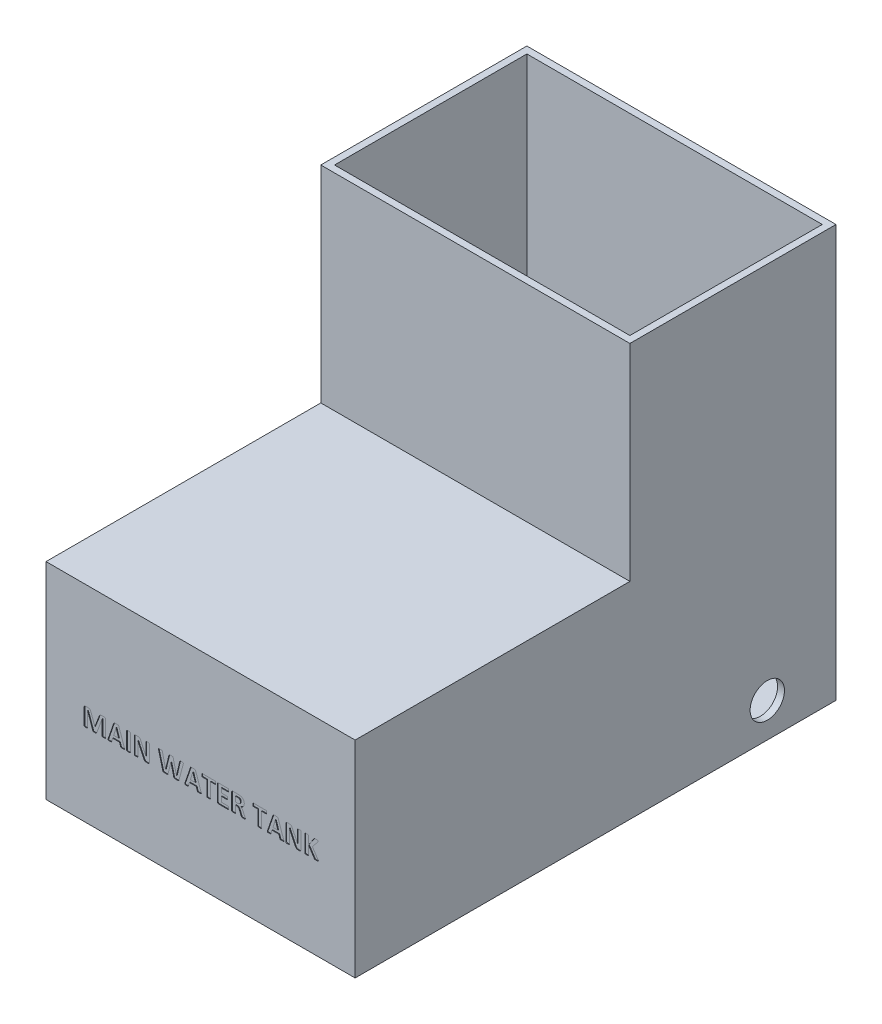
from build123d import *

# Parameters (mm, degrees)
SKETCH1_W           = 450
SKETCH1_H           = 400
BOSS_EXTRUDE1_DEPTH = 300
SKETCH3_W           = 450
SKETCH3_H           = 300
BOSS_EXTRUDE2_DEPTH = 600
SHELL3_T            = -10
CUT_EXTRUDE1_REACH  = 903.388
SKETCH5_R           = 25
CUT_EXTRUDE2_DEPTH  = 1


with BuildPart() as part:
    # Sketch1 → Boss-Extrude1 (new body)
    with BuildSketch(Plane(origin=(0, 0, 0), x_dir=(1, 0, 0), z_dir=(0, 1, 0))):
        Rectangle(SKETCH1_W, SKETCH1_H)
    extrude(amount=BOSS_EXTRUDE1_DEPTH)

    # Sketch3 → Boss-Extrude2 (add)
    with BuildSketch(Plane(origin=(0, 0, 0), x_dir=(1, 0, 0), z_dir=(0, 1, 0))):
        with Locations((0, 350)):
            Rectangle(SKETCH3_W, SKETCH3_H)
    extrude(amount=BOSS_EXTRUDE2_DEPTH)

    # Shell3
    shell3_openings = [part.faces().sort_by_distance(p)[0] for p in [
        (0, 600, -350),
    ]]
    offset(amount=SHELL3_T, openings=shell3_openings, kind=Kind.INTERSECTION)

    # Sketch5 → Cut-Extrude1 (cut, up to next)
    with BuildSketch(Plane(origin=(225, 0, 0), x_dir=(0, 0, -1), z_dir=(1, 0, 0)), mode=Mode.PRIVATE) as cut_extrude1_sk1:
        with Locations((400, 50)):
            Circle(SKETCH5_R)
    cut_extrude1_tool1 = extrude(cut_extrude1_sk1.sketch, amount=-CUT_EXTRUDE1_REACH, mode=Mode.PRIVATE) & part.part
    add(cut_extrude1_tool1.solids().sort_by_distance((225, 50, -400))[0], mode=Mode.SUBTRACT)

    # Sketch6 → Cut-Extrude2 (cut)
    # profile 1 of 13: a face of its own
    with BuildSketch(Plane.XY.offset(200)):
        with BuildLine():
            add(Edge.make_bspline(
                [(-138.322610294, 120.857220818), (-138.328988076, 120.791591808), (-138.341707054, 120.660710247), (-138.43073585, 120.472537539), (-138.606275854, 120.317906263), (-138.868093149, 120.209130229), (-139.21453384, 120.122228623), (-139.659517481, 120.04821173), (-140.22088397, 120.011401318), (-140.634840904, 120.00406116), (-140.863874847, 120)],
                knots=[0, 0, 0, 0, 0.53931148, 1.075529369, 1.664717629, 2.417171342, 3.3825244, 4.59796581, 6.11772375, 8, 8, 8, 8], degree=3))
            add(Edge.make_bspline(
                [(-140.863874847, 120), (-141.08677583, 120.004254973), (-141.492533144, 120.012000505), (-142.04637684, 120.047316457), (-142.485181407, 120.125322745), (-142.83293511, 120.198525314), (-143.085436478, 120.322545284), (-143.265578864, 120.471466481), (-143.361938599, 120.657497755), (-143.374609281, 120.787438048), (-143.380821078, 120.851141238)],
                knots=[0, 0, 0, 0, 1.853491538, 3.373999249, 4.603471061, 5.559413693, 6.312685071, 6.921158648, 7.471098346, 8, 8, 8, 8], degree=3))
            Line((-143.380821078, 120.851141238), (-143.380821078, 142.178308824))
            Line((-143.380821078, 142.178308824), (-143.42337814, 142.178308824))
            Line((-143.42337814, 142.178308824), (-151.278195849, 120.875459559))
            add(Edge.make_bspline(
                [(-151.278195849, 120.875459559), (-151.310361242, 120.792152176), (-151.372761692, 120.630536923), (-151.541065349, 120.424104841), (-151.773443967, 120.270592005), (-152.065785171, 120.148788624), (-152.435446863, 120.065783535), (-152.888346606, 120.024296543), (-153.436180583, 120.001284032), (-153.833613582, 120.000453309), (-154.050484452, 120)],
                knots=[0, 0, 0, 0, 0.686484186, 1.331770514, 2.017719291, 2.817120945, 3.76613975, 4.931024301, 6.325324192, 8, 8, 8, 8], degree=3))
            add(Edge.make_bspline(
                [(-154.050484452, 120), (-154.265329064, 120.002081485), (-154.660939361, 120.005914288), (-155.207695392, 120.038956227), (-155.661664789, 120.103535928), (-156.03388503, 120.19579303), (-156.324377464, 120.327076582), (-156.556975921, 120.470194253), (-156.717229477, 120.659275056), (-156.771830866, 120.804598993), (-156.798454733, 120.875459559)],
                knots=[0, 0, 0, 0, 1.685888108, 3.104358486, 4.294019542, 5.281467246, 6.100061193, 6.788077155, 7.409061302, 8, 8, 8, 8], degree=3))
            Line((-156.798454733, 120.875459559), (-164.349293428, 142.178308824))
            Line((-164.349293428, 142.178308824), (-164.39185049, 142.178308824))
            Line((-164.39185049, 142.178308824), (-164.39185049, 120.851141238))
            add(Edge.make_bspline(
                [(-164.39185049, 120.851141238), (-164.398485261, 120.787606691), (-164.411924227, 120.658915178), (-164.499843833, 120.47227323), (-164.67811813, 120.31732676), (-164.941109501, 120.200068015), (-165.295582108, 120.126324488), (-165.736540456, 120.047635327), (-166.294266981, 120.011322551), (-166.70411793, 120.004058604), (-166.933115043, 120)],
                knots=[0, 0, 0, 0, 0.523881482, 1.061140814, 1.651473397, 2.427583288, 3.406823418, 4.62462546, 6.11406799, 8, 8, 8, 8], degree=3))
            add(Edge.make_bspline(
                [(-166.933115043, 120), (-167.156059037, 120.004134635), (-167.561894646, 120.011661109), (-168.115261789, 120.048310383), (-168.559755881, 120.123375907), (-168.909218936, 120.207894012), (-169.171702826, 120.318325077), (-169.349437748, 120.470963587), (-169.429438647, 120.662329185), (-169.443143796, 120.791848029), (-169.450061275, 120.857220818)],
                knots=[0, 0, 0, 0, 1.845598522, 3.359631215, 4.583867372, 5.572415917, 6.33031427, 6.923765806, 7.456786145, 8, 8, 8, 8], degree=3))
            Line((-169.450061275, 120.857220818), (-169.450061275, 144.318321078))
            add(Edge.make_bspline(
                [(-169.450061275, 144.318321078), (-169.443229181, 144.481024454), (-169.430179678, 144.791792742), (-169.327995798, 145.227734692), (-169.156364307, 145.604363029), (-168.913213548, 145.914641397), (-168.612877049, 146.161836402), (-168.257506242, 146.331772506), (-167.859325721, 146.438945767), (-167.578282083, 146.45168587), (-167.431640625, 146.458333333)],
                knots=[0, 0, 0, 0, 1.170986061, 2.236618205, 3.203067292, 4.128640435, 5.05190886, 5.978862082, 6.945421388, 8, 8, 8, 8], degree=3))
            Line((-167.431640625, 146.458333333), (-163.917643229, 146.458333333))
            add(Edge.make_bspline(
                [(-163.917643229, 146.458333333), (-163.627364755, 146.452960748), (-163.086671153, 146.442953383), (-162.333718355, 146.32958902), (-161.682228084, 146.134485564), (-161.136566877, 145.814351863), (-160.666871807, 145.395787114), (-160.298617731, 144.84709899), (-159.981541996, 144.185593453), (-159.833020611, 143.69078237), (-159.753130744, 143.424622779)],
                knots=[0, 0, 0, 0, 1.221860144, 2.275924746, 3.199259799, 4.067557721, 4.91975897, 5.826849192, 6.83105906, 8, 8, 8, 8], degree=3))
            Line((-159.753130744, 143.424622779), (-153.886335784, 127.733226103))
            Line((-153.886335784, 127.733226103), (-153.801221661, 127.733226103))
            Line((-153.801221661, 127.733226103), (-147.69124349, 143.382065717))
            add(Edge.make_bspline(
                [(-147.69124349, 143.382065717), (-147.603018532, 143.647388745), (-147.438651477, 144.141697451), (-147.134417442, 144.809253764), (-146.794851864, 145.358730543), (-146.396227332, 145.794821319), (-145.92787215, 146.124524871), (-145.372843916, 146.328506029), (-144.741349978, 146.441801327), (-144.293278926, 146.452604247), (-144.055654488, 146.458333333)],
                knots=[0, 0, 0, 0, 1.280036071, 2.384764634, 3.352991371, 4.226577935, 5.073725477, 5.949430069, 6.912526206, 8, 8, 8, 8], degree=3))
            Line((-144.055654488, 146.458333333), (-140.444383808, 146.458333333))
            add(Edge.make_bspline(
                [(-140.444383808, 146.458333333), (-140.27326206, 146.452944755), (-139.953305092, 146.442869395), (-139.512118259, 146.327687643), (-139.133774381, 146.162586344), (-138.834893841, 145.909335288), (-138.602472904, 145.594600075), (-138.442566966, 145.217431758), (-138.334085104, 144.786351077), (-138.326553513, 144.479155522), (-138.322610294, 144.318321078)],
                knots=[0, 0, 0, 0, 1.189765225, 2.224577975, 3.160009884, 4.042747863, 4.921519989, 5.863966938, 6.881664521, 8, 8, 8, 8], degree=3))
            Line((-138.322610294, 144.318321078), (-138.322610294, 120.857220818))
        make_face()
    # profile 2 of 13: a face of its own
    with BuildSketch(Plane.XY.offset(200)):
        with BuildLine():
            add(Edge.make_bspline(
                [(-110.891544118, 122.109614354), (-110.8516296, 121.994539986), (-110.777221586, 121.780020162), (-110.692826331, 121.470326633), (-110.625226819, 121.201192257), (-110.579143746, 120.966510408), (-110.561808304, 120.763267235), (-110.587470729, 120.587976696), (-110.639832865, 120.433101083), (-110.743585158, 120.308885509), (-110.883095929, 120.207655229), (-111.068364248, 120.138573533), (-111.291373794, 120.076511657), (-111.561511231, 120.043651259), (-111.878427785, 120.03056614), (-112.244995629, 120.007617957), (-112.668842049, 120.006919226), (-112.968747075, 120.002407994), (-113.128829657, 120)],
                knots=[0, 0, 0, 0, 1.351975101, 2.52033068, 3.562719996, 4.432170766, 5.176088948, 5.812532786, 6.389296298, 6.965620705, 7.577732788, 8.283941723, 9.146375963, 10.145613058, 11.295182858, 12.669444765, 14.222224263, 16, 16, 16, 16], degree=3))
            add(Edge.make_bspline(
                [(-113.128829657, 120), (-113.292976139, 119.999609239), (-113.603044679, 119.9988711), (-114.038854426, 120.003712546), (-114.417683727, 120.018285792), (-114.823835328, 120.029418538), (-115.230728963, 120.068139739), (-115.621983013, 120.131971726), (-115.90276152, 120.238905599), (-116.093991463, 120.396618094), (-116.203154214, 120.605206179), (-116.255797023, 120.753229501), (-116.284131817, 120.832902497)],
                knots=[0, 0, 0, 0, 1.402041787, 2.648421349, 3.722147351, 4.640185661, 6.117966101, 7.211050041, 8.017924191, 8.656254393, 9.276733986, 10, 10, 10, 10], degree=3))
            Line((-116.284131817, 120.832902497), (-117.901300169, 125.836397059))
            Line((-117.901300169, 125.836397059), (-127.883970971, 125.836397059))
            Line((-127.883970971, 125.836397059), (-129.416025199, 120.972732843))
            add(Edge.make_bspline(
                [(-129.416025199, 120.972732843), (-129.443752703, 120.884713022), (-129.496553959, 120.717097606), (-129.616453428, 120.485580756), (-129.809566712, 120.303011001), (-130.081846419, 120.165939025), (-130.457871884, 120.083675106), (-130.950180117, 120.023860215), (-131.588489743, 120.010269187), (-132.062726867, 120.003684991), (-132.328144148, 120)],
                knots=[0, 0, 0, 0, 0.662368552, 1.261342941, 1.847645799, 2.537239812, 3.42265718, 4.595262896, 6.094463672, 8, 8, 8, 8], degree=3))
            add(Edge.make_bspline(
                [(-132.328144148, 120), (-132.476087273, 120.001525247), (-132.755810555, 120.004409107), (-133.151098974, 120.016084606), (-133.495657135, 120.034525263), (-133.792648735, 120.055109454), (-134.041719454, 120.095430131), (-134.25117521, 120.156791637), (-134.420510192, 120.237604109), (-134.594798169, 120.380107688), (-134.710385748, 120.656349141), (-134.69696794, 121.062574302), (-134.568619053, 121.565980297), (-134.450163099, 121.94015335), (-134.383042279, 122.152171415)],
                knots=[0, 0, 0, 0, 1.279822224, 2.419822313, 3.420424811, 4.264789446, 4.993926375, 5.598399463, 6.14718048, 6.607326483, 7.517039103, 8.604050794, 10.075749779, 12, 12, 12, 12], degree=3))
            Line((-134.383042279, 122.152171415), (-126.382314645, 145.406565947))
            add(Edge.make_bspline(
                [(-126.382314645, 145.406565947), (-126.340510943, 145.51108387), (-126.263205294, 145.704364021), (-126.109208731, 145.968231653), (-125.878194819, 146.174323496), (-125.54214764, 146.301587817), (-125.102814429, 146.397877715), (-124.65010252, 146.427302492), (-124.213981433, 146.440259857), (-123.818840947, 146.454304786), (-123.372938524, 146.459540733), (-123.058811536, 146.458751071), (-122.89263557, 146.458333333)],
                knots=[0, 0, 0, 0, 0.856868194, 1.584566637, 2.305859304, 3.162727498, 4.285524966, 5.725550839, 6.605441018, 7.608682037, 8.734971556, 10, 10, 10, 10], degree=3))
            add(Edge.make_bspline(
                [(-122.89263557, 146.458333333), (-122.702141329, 146.458733727), (-122.339379737, 146.459496204), (-121.826610995, 146.454416602), (-121.374712393, 146.440402567), (-120.881934021, 146.427075293), (-120.376813067, 146.399045154), (-119.886524958, 146.302045669), (-119.517339678, 146.172300629), (-119.260097621, 145.956955781), (-119.092836308, 145.672971209), (-119.017981795, 145.46082409), (-118.977385876, 145.345770144)],
                knots=[0, 0, 0, 0, 1.298203691, 2.47219252, 3.494555852, 4.378870695, 5.833194716, 6.932857721, 7.781737059, 8.467837287, 9.169060755, 10, 10, 10, 10], degree=3))
            Line((-118.977385876, 145.345770144), (-110.891544118, 122.109614354))
        make_face()
        Polygon((-122.953431373, 141.515634574), (-122.971670113, 141.515634574), (-126.540383732, 130.116421569), (-119.28136489, 130.116421569), align=None, mode=Mode.SUBTRACT)
    # profile 3 of 13: a face of its own
    with BuildSketch(Plane.XY.offset(200)):
        with BuildLine():
            add(Edge.make_bspline(
                [(-102.136948529, 120.851141238), (-102.142358465, 120.787024341), (-102.153559926, 120.65426808), (-102.267154458, 120.470938348), (-102.45982677, 120.319480374), (-102.735190296, 120.199970681), (-103.107414237, 120.124895644), (-103.579076282, 120.047139591), (-104.177229528, 120.011836126), (-104.617423751, 120.004211871), (-104.86060049, 120)],
                knots=[0, 0, 0, 0, 0.495621344, 1.026201209, 1.620351712, 2.38321719, 3.340319487, 4.57034235, 6.105352312, 8, 8, 8, 8], degree=3))
            add(Edge.make_bspline(
                [(-104.86060049, 120), (-105.099704593, 120.004399941), (-105.537828303, 120.012462197), (-106.134166912, 120.046443359), (-106.609351484, 120.126011115), (-106.984601975, 120.198716155), (-107.260434385, 120.319990848), (-107.455764159, 120.469060588), (-107.558811015, 120.656674414), (-107.57590813, 120.787359714), (-107.584252451, 120.851141238)],
                knots=[0, 0, 0, 0, 1.864371396, 3.416191113, 4.647059884, 5.620195157, 6.383585271, 6.978144381, 7.501278959, 8, 8, 8, 8], degree=3))
            Line((-107.584252451, 120.851141238), (-107.584252451, 145.607192096))
            add(Edge.make_bspline(
                [(-107.584252451, 145.607192096), (-107.576498802, 145.673215443), (-107.561065, 145.80463631), (-107.453071722, 145.991729445), (-107.256273507, 146.137536486), (-106.974391873, 146.251382586), (-106.600398455, 146.335083766), (-106.125414291, 146.408151354), (-105.534351001, 146.456784164), (-105.099836221, 146.457783253), (-104.86060049, 146.458333333)],
                knots=[0, 0, 0, 0, 0.514492339, 1.024107864, 1.631220341, 2.388587514, 3.381256653, 4.612737383, 6.135036404, 8, 8, 8, 8], degree=3))
            add(Edge.make_bspline(
                [(-104.86060049, 146.458333333), (-104.617284698, 146.457872141), (-104.17664827, 146.457036937), (-103.579793698, 146.407891723), (-103.105765526, 146.337461199), (-102.738038355, 146.248506896), (-102.458124559, 146.140267103), (-102.269598897, 145.987619421), (-102.15120746, 145.807275548), (-102.141683553, 145.673634657), (-102.136948529, 145.607192096)],
                knots=[0, 0, 0, 0, 1.894249435, 3.430419785, 4.660397522, 5.621231422, 6.377674247, 6.971802951, 7.488808818, 8, 8, 8, 8], degree=3))
            Line((-102.136948529, 145.607192096), (-102.136948529, 120.851141238))
        make_face()
    # profile 4 of 13: a face of its own
    with BuildSketch(Plane.XY.offset(200)):
        with BuildLine():
            add(Edge.make_bspline(
                [(-74.511335784, 121.915067785), (-74.518555448, 121.766007981), (-74.532499906, 121.478105649), (-74.665692505, 121.079085856), (-74.861479765, 120.736285051), (-75.123193273, 120.457560706), (-75.439446187, 120.239339627), (-75.804611876, 120.097857442), (-76.194215665, 120.021115537), (-76.458517645, 120.007034378), (-76.590552237, 120)],
                knots=[0, 0, 0, 0, 1.120032347, 2.163292293, 3.135130692, 4.07524891, 5.019946156, 6.00690811, 7.004331812, 8, 8, 8, 8], degree=3))
            Line((-76.590552237, 120), (-78.949429381, 120))
            add(Edge.make_bspline(
                [(-78.949429381, 120), (-79.17877411, 120.006339978), (-79.606076885, 120.018152284), (-80.214493595, 120.122137635), (-80.752316346, 120.343072501), (-81.23941737, 120.684822126), (-81.688919653, 121.156851637), (-82.115742411, 121.770622498), (-82.546594854, 122.539635814), (-82.827205018, 123.111194922), (-82.9801911, 123.422803692)],
                knots=[0, 0, 0, 0, 0.966254035, 1.800272596, 2.585200708, 3.395271146, 4.288963202, 5.317323791, 6.537429596, 8, 8, 8, 8], degree=3))
            Line((-82.9801911, 123.422803692), (-89.150965074, 136.044012331))
            add(Edge.make_bspline(
                [(-89.150965074, 136.044012331), (-89.332721906, 136.432462184), (-89.708684609, 137.235967914), (-90.25385454, 138.471984662), (-90.767717258, 139.740334105), (-91.086143627, 140.59284763), (-91.242340686, 141.011029412)],
                knots=[0, 0, 0, 0, 0.954558477, 1.974497353, 3.006434174, 4, 4, 4, 4], degree=3))
            Line((-91.242340686, 141.011029412), (-91.284897748, 141.011029412))
            add(Edge.make_bspline(
                [(-91.284897748, 141.011029412), (-91.273428065, 140.512525813), (-91.250537302, 139.517631034), (-91.240131383, 138.019888205), (-91.242916732, 136.502008488), (-91.242534723, 135.480638267), (-91.242340686, 134.961847044)],
                knots=[0, 0, 0, 0, 0.989090355, 1.973989423, 2.970915262, 4, 4, 4, 4], degree=3))
            Line((-91.242340686, 134.961847044), (-91.242340686, 120.8936983))
            add(Edge.make_bspline(
                [(-91.242340686, 120.8936983), (-91.24847816, 120.82792779), (-91.26097155, 120.694045893), (-91.357133864, 120.504643303), (-91.530570428, 120.344236853), (-91.784795754, 120.218222799), (-92.131950853, 120.12735388), (-92.578559725, 120.046281296), (-93.14885803, 120.01198749), (-93.568804455, 120.00427813), (-93.80184398, 120)],
                knots=[0, 0, 0, 0, 0.533239368, 1.085457576, 1.679302583, 2.423102222, 3.366158425, 4.586936804, 6.105999776, 8, 8, 8, 8], degree=3))
            add(Edge.make_bspline(
                [(-93.80184398, 120), (-94.028818579, 120.004169823), (-94.442708461, 120.011773527), (-95.004421446, 120.047951055), (-95.449234102, 120.121612001), (-95.79286667, 120.208566861), (-96.035271997, 120.340785978), (-96.205832495, 120.49064075), (-96.287554273, 120.680083467), (-96.296197988, 120.810017266), (-96.300551471, 120.875459559)],
                knots=[0, 0, 0, 0, 1.880338663, 3.428811631, 4.65383513, 5.615149483, 6.343797838, 6.92541045, 7.458773589, 8, 8, 8, 8], degree=3))
            Line((-96.300551471, 120.875459559), (-96.300551471, 144.543265548))
            add(Edge.make_bspline(
                [(-96.300551471, 144.543265548), (-96.29448518, 144.694013321), (-96.28298664, 144.979752908), (-96.171940497, 145.378750124), (-95.987505466, 145.719592894), (-95.722671108, 145.988364751), (-95.413471474, 146.203266873), (-95.059272962, 146.346180523), (-94.678377886, 146.442754499), (-94.412459499, 146.453051352), (-94.276051241, 146.458333333)],
                knots=[0, 0, 0, 0, 1.146599659, 2.173358234, 3.127386818, 4.066803063, 5.022080866, 5.977233821, 6.962380843, 8, 8, 8, 8], degree=3))
            Line((-94.276051241, 146.458333333), (-91.272738588, 146.458333333))
            add(Edge.make_bspline(
                [(-91.272738588, 146.458333333), (-91.022914758, 146.455213429), (-90.565237131, 146.44949776), (-89.931927042, 146.342563897), (-89.38309123, 146.175181842), (-88.904129076, 145.89634296), (-88.466848372, 145.520012029), (-88.071001709, 145.025330449), (-87.693407131, 144.414415077), (-87.470665721, 143.955869634), (-87.351409314, 143.710363051)],
                knots=[0, 0, 0, 0, 1.157819279, 2.121126641, 2.971782284, 3.805898374, 4.67303314, 5.635237899, 6.733899397, 8, 8, 8, 8], degree=3))
            Line((-87.351409314, 143.710363051), (-82.54246132, 134.086387485))
            add(Edge.make_bspline(
                [(-82.54246132, 134.086387485), (-82.402226882, 133.796787544), (-82.124911323, 133.224099621), (-81.718381263, 132.366584173), (-81.305193138, 131.525142088), (-80.921462178, 130.680604947), (-80.543082432, 129.848355178), (-80.178535018, 129.024563029), (-79.817869731, 128.208728521), (-79.583312073, 127.664507711), (-79.466193704, 127.392769608)],
                knots=[0, 0, 0, 0, 1.048159491, 2.072750013, 3.091389825, 4.101587992, 5.094292605, 6.069547355, 7.0360943, 8, 8, 8, 8], degree=3))
            Line((-79.466193704, 127.392769608), (-79.447954963, 127.392769608))
            add(Edge.make_bspline(
                [(-79.447954963, 127.392769608), (-79.467749211, 127.875033939), (-79.508160697, 128.859613835), (-79.539814278, 130.347353605), (-79.567435787, 131.830761718), (-79.56885473, 132.811688837), (-79.569546569, 133.289962469)],
                knots=[0, 0, 0, 0, 0.981864332, 2.004551901, 3.027073275, 4, 4, 4, 4], degree=3))
            Line((-79.569546569, 133.289962469), (-79.569546569, 145.588953355))
            add(Edge.make_bspline(
                [(-79.569546569, 145.588953355), (-79.564144287, 145.65309547), (-79.553193763, 145.783112717), (-79.443090416, 145.963943897), (-79.26076072, 146.119554589), (-78.997065885, 146.252082649), (-78.643106763, 146.352424029), (-78.189138436, 146.412068808), (-77.620885085, 146.455768733), (-77.200660491, 146.457418121), (-76.967486213, 146.458333333)],
                knots=[0, 0, 0, 0, 0.513514522, 1.040903369, 1.654763982, 2.430140109, 3.402872071, 4.610164628, 6.119047709, 8, 8, 8, 8], degree=3))
            add(Edge.make_bspline(
                [(-76.967486213, 146.458333333), (-76.744433279, 146.457379295), (-76.338361569, 146.455642453), (-75.786452224, 146.411255806), (-75.345927101, 146.354663063), (-75.010884313, 146.254285375), (-74.773244314, 146.118818781), (-74.617334962, 145.959377371), (-74.52123482, 145.778899807), (-74.514667979, 145.64885969), (-74.511335784, 145.582873775)],
                knots=[0, 0, 0, 0, 1.872486456, 3.408893843, 4.648537669, 5.595853804, 6.328496016, 6.918324485, 7.451128226, 8, 8, 8, 8], degree=3))
            Line((-74.511335784, 145.582873775), (-74.511335784, 121.915067785))
        make_face()
    # profile 5 of 13: a face of its own
    with BuildSketch(Plane.XY.offset(200)):
        with BuildLine():
            add(Edge.make_bspline(
                [(-31.413191253, 121.477338006), (-31.456791553, 121.329788498), (-31.537163343, 121.057799132), (-31.726143074, 120.691533754), (-32.016624517, 120.41792779), (-32.408260329, 120.229841379), (-32.906834902, 120.110564726), (-33.528658637, 120.035039613), (-34.300729613, 120.00660726), (-34.86842232, 120.002353589), (-35.18253102, 120)],
                knots=[0, 0, 0, 0, 0.828472167, 1.527186518, 2.191185698, 2.938119969, 3.840992575, 4.941785944, 6.307866865, 8, 8, 8, 8], degree=3))
            add(Edge.make_bspline(
                [(-35.18253102, 120), (-35.364906167, 120.002406446), (-35.711421324, 120.006978725), (-36.20414292, 120.007629291), (-36.63957602, 120.030818102), (-37.121631806, 120.047264834), (-37.620523419, 120.109768955), (-38.116482001, 120.226150597), (-38.490898394, 120.416502883), (-38.749252669, 120.696906231), (-38.911736129, 121.06029047), (-38.97702679, 121.330073337), (-39.01266659, 121.477338006)],
                knots=[0, 0, 0, 0, 1.200390798, 2.280758157, 3.241844714, 4.069696988, 5.454290943, 6.544491945, 7.409847109, 8.174247725, 9.003388151, 10, 10, 10, 10], degree=3))
            Line((-39.01266659, 121.477338006), (-43.146781173, 138.092830882))
            Line((-43.146781173, 138.092830882), (-43.189338235, 138.092830882))
            Line((-43.189338235, 138.092830882), (-47.280895757, 121.477338006))
            add(Edge.make_bspline(
                [(-47.280895757, 121.477338006), (-47.316457953, 121.335914503), (-47.383013225, 121.071237945), (-47.553052219, 120.716250072), (-47.808107737, 120.426504915), (-48.185924884, 120.235163409), (-48.677556079, 120.106754276), (-49.17408569, 120.047503497), (-49.649909767, 120.031027683), (-50.081311811, 120.007382126), (-50.567954984, 120.007073853), (-50.912443723, 120.002430774), (-51.092792586, 120)],
                knots=[0, 0, 0, 0, 0.964606664, 1.805278237, 2.584746217, 3.474186178, 4.562364076, 5.943010412, 6.776466711, 7.71722888, 8.804909628, 10, 10, 10, 10], degree=3))
            add(Edge.make_bspline(
                [(-51.092792586, 120), (-51.283274336, 120.002404185), (-51.641950108, 120.006931248), (-52.150871787, 120.007654514), (-52.598482972, 120.030870093), (-53.092617296, 120.047135089), (-53.601956584, 120.108755795), (-54.106591416, 120.228078233), (-54.490544215, 120.414473068), (-54.756987286, 120.696103275), (-54.923831483, 121.061385362), (-55.001848762, 121.330272235), (-55.044519761, 121.477338006)],
                knots=[0, 0, 0, 0, 1.226427643, 2.309354474, 3.275578471, 4.111462609, 5.491790153, 6.570859358, 7.440377765, 8.197066898, 9.013898509, 10, 10, 10, 10], degree=3))
            Line((-55.044519761, 121.477338006), (-61.087622549, 144.34871898))
            add(Edge.make_bspline(
                [(-61.087622549, 144.34871898), (-61.114542275, 144.464106399), (-61.164940551, 144.680131147), (-61.227348069, 144.985932632), (-61.268931618, 145.252081177), (-61.306612676, 145.539013993), (-61.282643263, 145.859073936), (-61.102227305, 146.106778188), (-60.906118234, 146.245652923), (-60.711003107, 146.319071758), (-60.478110962, 146.374529029), (-60.202741244, 146.407662472), (-59.876044496, 146.430123156), (-59.494994972, 146.450016682), (-59.057021028, 146.451589341), (-58.746975608, 146.455998889), (-58.582835478, 146.458333333)],
                knots=[0, 0, 0, 0, 1.131713364, 2.118758674, 2.981202209, 3.70160486, 4.892526967, 5.934423668, 6.503746327, 7.172352893, 7.90946648, 8.788265191, 9.817133147, 11.038040768, 12.431918871, 14, 14, 14, 14], degree=3))
            add(Edge.make_bspline(
                [(-58.582835478, 146.458333333), (-58.430845038, 146.458721053), (-58.141035031, 146.459460344), (-57.733630207, 146.454554517), (-57.374950153, 146.440304626), (-56.987503265, 146.427085487), (-56.594130717, 146.400684076), (-56.22467302, 146.302469752), (-55.953509248, 146.17167867), (-55.784928094, 145.957922158), (-55.701995379, 145.68012352), (-55.662514741, 145.477771628), (-55.640318627, 145.364008885)],
                knots=[0, 0, 0, 0, 1.288700235, 2.457248118, 3.454435296, 4.331425027, 5.747093502, 6.780913502, 7.565316964, 8.249610182, 9.015926434, 10, 10, 10, 10], degree=3))
            Line((-55.640318627, 145.364008885), (-50.97120098, 125.289234835))
            Line((-50.97120098, 125.289234835), (-50.95296224, 125.289234835))
            Line((-50.95296224, 125.289234835), (-46.028502221, 145.224178539))
            add(Edge.make_bspline(
                [(-46.028502221, 145.224178539), (-46.001123644, 145.340407223), (-45.950445315, 145.555548988), (-45.834205796, 145.851114758), (-45.636746674, 146.083979938), (-45.344515261, 146.244407619), (-44.959560008, 146.355510672), (-44.566301959, 146.39953171), (-44.188767243, 146.430417235), (-43.844134387, 146.44974878), (-43.452768234, 146.451667243), (-43.177171528, 146.456025859), (-43.031269148, 146.458333333)],
                knots=[0, 0, 0, 0, 0.991997648, 1.836208739, 2.612054163, 3.472220261, 4.563607158, 5.922711611, 6.750146941, 7.710810409, 8.788090707, 10, 10, 10, 10], degree=3))
            add(Edge.make_bspline(
                [(-43.031269148, 146.458333333), (-42.87723289, 146.459591248), (-42.583289188, 146.461991696), (-42.170006905, 146.446033361), (-41.804990656, 146.436411351), (-41.407184606, 146.413202408), (-40.995892114, 146.375012125), (-40.596793457, 146.268723894), (-40.296081925, 146.110356122), (-40.103663788, 145.868250884), (-39.974034559, 145.569810196), (-39.922570925, 145.346990179), (-39.894205729, 145.224178539)],
                knots=[0, 0, 0, 0, 1.228277533, 2.343892593, 3.297971527, 4.139769378, 5.522974951, 6.58189546, 7.42182955, 8.179183829, 8.996421316, 10, 10, 10, 10], degree=3))
            Line((-39.894205729, 145.224178539), (-35.018382353, 125.289234835))
            Line((-35.018382353, 125.289234835), (-34.975825291, 125.289234835))
            Line((-34.975825291, 125.289234835), (-30.349264706, 145.303213082))
            add(Edge.make_bspline(
                [(-30.349264706, 145.303213082), (-30.326362771, 145.40284465), (-30.283214537, 145.590554831), (-30.198631844, 145.858078667), (-30.041589329, 146.091358674), (-29.767302001, 146.243096527), (-29.403459678, 146.358988279), (-29.018625735, 146.399292939), (-28.641315926, 146.430753765), (-28.288495044, 146.449874538), (-27.88094183, 146.451653629), (-27.59115601, 146.45601528), (-27.437145757, 146.458333333)],
                knots=[0, 0, 0, 0, 0.875411882, 1.649313821, 2.395684222, 3.214212243, 4.273299352, 5.657392683, 6.510506289, 7.518311766, 8.681076133, 10, 10, 10, 10], degree=3))
            add(Edge.make_bspline(
                [(-27.437145757, 146.458333333), (-27.293269396, 146.456003004), (-27.021724677, 146.451604861), (-26.638465691, 146.449979899), (-26.305934595, 146.430305998), (-25.953260771, 146.401764928), (-25.595382683, 146.346799133), (-25.259588319, 146.15930683), (-25.071500426, 145.84293657), (-25.06926241, 145.520426621), (-25.102601637, 145.223652731), (-25.144421946, 144.946834693), (-25.215614114, 144.6323306), (-25.264857335, 144.407519174), (-25.291053922, 144.287923177)],
                knots=[0, 0, 0, 0, 1.252588424, 2.364069893, 3.33573087, 4.150248658, 5.447623475, 6.461137435, 7.386877247, 8.501713295, 9.193295655, 9.996657773, 10.934254751, 12, 12, 12, 12], degree=3))
            Line((-25.291053922, 144.287923177), (-31.413191253, 121.477338006))
        make_face()
    # profile 6 of 13: a face of its own
    with BuildSketch(Plane.XY.offset(200)):
        with BuildLine():
            add(Edge.make_bspline(
                [(0.778186275, 122.109614354), (0.818100792, 121.994539986), (0.892508806, 121.780020162), (0.976904061, 121.470326633), (1.044503573, 121.201192257), (1.090586646, 120.966510408), (1.107922088, 120.763267235), (1.082259663, 120.587976696), (1.029897527, 120.433101083), (0.926145234, 120.308885509), (0.786634463, 120.207655229), (0.601366144, 120.138573533), (0.378356598, 120.076511657), (0.108219162, 120.043651259), (-0.208697393, 120.03056614), (-0.575265237, 120.007617957), (-0.999111657, 120.006919226), (-1.299016683, 120.002407994), (-1.459099265, 120)],
                knots=[0, 0, 0, 0, 1.351975101, 2.52033068, 3.562719996, 4.432170766, 5.176088948, 5.812532786, 6.389296298, 6.965620705, 7.577732788, 8.283941723, 9.146375963, 10.145613058, 11.295182858, 12.669444765, 14.222224263, 16, 16, 16, 16], degree=3))
            add(Edge.make_bspline(
                [(-1.459099265, 120), (-1.623245747, 119.999609239), (-1.933314287, 119.9988711), (-2.369124034, 120.003712546), (-2.747953335, 120.018285792), (-3.154104936, 120.029418538), (-3.560998571, 120.068139739), (-3.95225262, 120.131971726), (-4.233031128, 120.238905599), (-4.424261071, 120.396618094), (-4.533423822, 120.605206179), (-4.586066631, 120.753229501), (-4.614401425, 120.832902497)],
                knots=[0, 0, 0, 0, 1.402041787, 2.648421349, 3.722147351, 4.640185661, 6.117966101, 7.211050041, 8.017924191, 8.656254393, 9.276733986, 10, 10, 10, 10], degree=3))
            Line((-4.614401425, 120.832902497), (-6.231569776, 125.836397059))
            Line((-6.231569776, 125.836397059), (-16.214240579, 125.836397059))
            Line((-16.214240579, 125.836397059), (-17.746294807, 120.972732843))
            add(Edge.make_bspline(
                [(-17.746294807, 120.972732843), (-17.774022311, 120.884713022), (-17.826823567, 120.717097606), (-17.946723036, 120.485580756), (-18.13983632, 120.303011001), (-18.412116027, 120.165939025), (-18.788141491, 120.083675106), (-19.280449725, 120.023860215), (-19.918759351, 120.010269187), (-20.392996474, 120.003684991), (-20.658413756, 120)],
                knots=[0, 0, 0, 0, 0.662368552, 1.261342941, 1.847645799, 2.537239812, 3.42265718, 4.595262896, 6.094463672, 8, 8, 8, 8], degree=3))
            add(Edge.make_bspline(
                [(-20.658413756, 120), (-20.80635688, 120.001525247), (-21.086080163, 120.004409107), (-21.481368582, 120.016084606), (-21.825926742, 120.034525263), (-22.122918343, 120.055109454), (-22.371989062, 120.095430131), (-22.581444818, 120.156791637), (-22.7507798, 120.237604109), (-22.925067777, 120.380107688), (-23.040655355, 120.656349141), (-23.027237548, 121.062574302), (-22.898888661, 121.565980297), (-22.780432707, 121.94015335), (-22.713311887, 122.152171415)],
                knots=[0, 0, 0, 0, 1.279822224, 2.419822313, 3.420424811, 4.264789446, 4.993926375, 5.598399463, 6.14718048, 6.607326483, 7.517039103, 8.604050794, 10.075749779, 12, 12, 12, 12], degree=3))
            Line((-22.713311887, 122.152171415), (-14.712584252, 145.406565947))
            add(Edge.make_bspline(
                [(-14.712584252, 145.406565947), (-14.670780551, 145.51108387), (-14.593474902, 145.704364021), (-14.439478339, 145.968231653), (-14.208464426, 146.174323496), (-13.872417248, 146.301587817), (-13.433084037, 146.397877715), (-12.980372128, 146.427302492), (-12.54425104, 146.440259857), (-12.149110555, 146.454304786), (-11.703208131, 146.459540733), (-11.389081144, 146.458751071), (-11.222905178, 146.458333333)],
                knots=[0, 0, 0, 0, 0.856868194, 1.584566637, 2.305859304, 3.162727498, 4.285524966, 5.725550839, 6.605441018, 7.608682037, 8.734971556, 10, 10, 10, 10], degree=3))
            add(Edge.make_bspline(
                [(-11.222905178, 146.458333333), (-11.032410937, 146.458733727), (-10.669649345, 146.459496204), (-10.156880602, 146.454416602), (-9.704982001, 146.440402567), (-9.212203629, 146.427075293), (-8.707082674, 146.399045154), (-8.216794566, 146.302045669), (-7.847609285, 146.172300629), (-7.590367229, 145.956955781), (-7.423105915, 145.672971209), (-7.348251402, 145.46082409), (-7.307655484, 145.345770144)],
                knots=[0, 0, 0, 0, 1.298203691, 2.47219252, 3.494555852, 4.378870695, 5.833194716, 6.932857721, 7.781737059, 8.467837287, 9.169060755, 10, 10, 10, 10], degree=3))
            Line((-7.307655484, 145.345770144), (0.778186275, 122.109614354))
        make_face()
        Polygon((-11.28370098, 141.515634574), (-11.301939721, 141.515634574), (-14.870653339, 130.116421569), (-7.611634498, 130.116421569), align=None, mode=Mode.SUBTRACT)
    # profile 7 of 13: a face of its own
    with BuildSketch(Plane.XY.offset(200)):
        with BuildLine():
            add(Edge.make_bspline(
                [(21.983762255, 144.306161918), (21.982812896, 144.127646459), (21.981061855, 143.798384526), (21.935110826, 143.348301291), (21.882027496, 142.975218291), (21.789784254, 142.681964662), (21.684447184, 142.450379318), (21.541957285, 142.291198519), (21.37130093, 142.195870528), (21.249258512, 142.184220007), (21.18733724, 142.178308824)],
                knots=[0, 0, 0, 0, 1.727489177, 3.186258664, 4.380030672, 5.366980201, 6.156890973, 6.823580194, 7.403113996, 8, 8, 8, 8], degree=3))
            Line((21.18733724, 142.178308824), (14.590992647, 142.178308824))
            Line((14.590992647, 142.178308824), (14.590992647, 120.857220818))
            add(Edge.make_bspline(
                [(14.590992647, 120.857220818), (14.585583612, 120.793100216), (14.574384017, 120.660336282), (14.460774135, 120.477069687), (14.268174299, 120.325313606), (13.990151881, 120.206421005), (13.615439381, 120.122595094), (13.138446926, 120.048512252), (12.542690374, 120.011673969), (12.10649519, 120.00413398), (11.867340686, 120)],
                knots=[0, 0, 0, 0, 0.495428615, 1.025802158, 1.619721617, 2.382290446, 3.358084909, 4.603221316, 6.137634369, 8, 8, 8, 8], degree=3))
            add(Edge.make_bspline(
                [(11.867340686, 120), (11.628206673, 120.004276225), (11.190028158, 120.012111789), (10.594024815, 120.047479709), (10.117453025, 120.123329714), (9.744165747, 120.206202013), (9.467436335, 120.325779663), (9.272191565, 120.475200205), (9.169126908, 120.662740567), (9.152031979, 120.79343489), (9.143688725, 120.857220818)],
                knots=[0, 0, 0, 0, 1.863507167, 3.414607538, 4.64490574, 5.621298315, 6.38433456, 6.978618062, 7.501510141, 8, 8, 8, 8], degree=3))
            Line((9.143688725, 120.857220818), (9.143688725, 142.178308824))
            Line((9.143688725, 142.178308824), (2.547344133, 142.178308824))
            add(Edge.make_bspline(
                [(2.547344133, 142.178308824), (2.483745825, 142.184493331), (2.358547906, 142.196667986), (2.181008336, 142.285417418), (2.053316279, 142.45722207), (1.934009558, 142.67781254), (1.858262805, 142.978018344), (1.787781214, 143.346597236), (1.757492796, 143.799123914), (1.753230984, 144.127844084), (1.750919118, 144.306161918)],
                knots=[0, 0, 0, 0, 0.615041605, 1.210754367, 1.850260391, 2.647570539, 3.626916286, 4.821718098, 6.275906385, 8, 8, 8, 8], degree=3))
            add(Edge.make_bspline(
                [(1.750919118, 144.306161918), (1.753164893, 144.490566603), (1.757291644, 144.829421495), (1.788171821, 145.295974993), (1.857073372, 145.673002573), (1.932893351, 145.97547617), (2.052778664, 146.192750493), (2.183221824, 146.35694544), (2.357865919, 146.44764872), (2.483611647, 146.45473948), (2.547344133, 146.458333333)],
                knots=[0, 0, 0, 0, 1.76052633, 3.235074862, 4.452992343, 5.420080963, 6.190359611, 6.807177194, 7.395434236, 8, 8, 8, 8], degree=3))
            Line((2.547344133, 146.458333333), (21.18733724, 146.458333333))
            add(Edge.make_bspline(
                [(21.18733724, 146.458333333), (21.247374189, 146.454792251), (21.36797122, 146.447679232), (21.533973655, 146.349307312), (21.685363816, 146.202177686), (21.790525105, 145.970800081), (21.883482514, 145.676032834), (21.934583332, 145.294208065), (21.98133242, 144.83018109), (21.982906226, 144.490773387), (21.983762255, 144.306161918)],
                knots=[0, 0, 0, 0, 0.567698481, 1.1403436, 1.798537057, 2.561762834, 3.536980895, 4.75483643, 6.234882676, 8, 8, 8, 8], degree=3))
        make_face()
    # profile 8 of 13: a face of its own
    with BuildSketch(Plane.XY.offset(200)):
        with BuildLine():
            add(Edge.make_bspline(
                [(40.660232843, 122.140012255), (40.659359187, 121.955427647), (40.657762529, 121.618088582), (40.612075691, 121.159731871), (40.558555796, 120.786917797), (40.46830379, 120.495314167), (40.352737429, 120.270303795), (40.206077569, 120.112150027), (40.032781553, 120.019627317), (39.911359457, 120.006470181), (39.851648667, 120)],
                knots=[0, 0, 0, 0, 1.772437912, 3.239232977, 4.423707261, 5.384401224, 6.159891517, 6.834724464, 7.426961607, 8, 8, 8, 8], degree=3))
            Line((39.851648667, 120), (26.330662148, 120))
            add(Edge.make_bspline(
                [(26.330662148, 120), (26.22091106, 120.004628705), (26.00693841, 120.013652909), (25.697656218, 120.085227621), (25.421760524, 120.21945872), (25.165187932, 120.386455974), (24.951342291, 120.623578179), (24.808023107, 120.930170334), (24.72264642, 121.294424709), (24.712735585, 121.555841712), (24.707414216, 121.696202895)],
                knots=[0, 0, 0, 0, 0.986134925, 1.922585978, 2.82696586, 3.731162354, 4.659788764, 5.653462416, 6.740086574, 8, 8, 8, 8], degree=3))
            Line((24.707414216, 121.696202895), (24.707414216, 144.762130438))
            add(Edge.make_bspline(
                [(24.707414216, 144.762130438), (24.712844133, 144.902450428), (24.722957132, 145.163790711), (24.80660293, 145.52676362), (24.952916218, 145.830232703), (25.167008641, 146.064947746), (25.420939076, 146.241587993), (25.702635258, 146.371314646), (26.014812286, 146.445528153), (26.230966118, 146.453966606), (26.342821308, 146.458333333)],
                knots=[0, 0, 0, 0, 1.255398639, 2.338128977, 3.311977815, 4.237276575, 5.148590167, 6.066205518, 6.999300883, 8, 8, 8, 8], degree=3))
            Line((26.342821308, 146.458333333), (39.863807828, 146.458333333))
            add(Edge.make_bspline(
                [(39.863807828, 146.458333333), (39.9234797, 146.454194911), (40.042404198, 146.445947141), (40.209582297, 146.360130378), (40.353194182, 146.205159217), (40.459693443, 145.972948868), (40.560347845, 145.674696355), (40.610807498, 145.294174485), (40.658501397, 144.83024398), (40.65961662, 144.488767451), (40.660232843, 144.300082338)],
                knots=[0, 0, 0, 0, 0.566414176, 1.128848811, 1.744661206, 2.549421896, 3.546753268, 4.742756138, 6.200188366, 8, 8, 8, 8], degree=3))
            add(Edge.make_bspline(
                [(40.660232843, 144.300082338), (40.659431555, 144.119524581), (40.657961221, 143.788208029), (40.610865294, 143.336248476), (40.560684379, 142.964050252), (40.461854454, 142.673910714), (40.345708531, 142.453170293), (40.21261246, 142.289276526), (40.043144838, 142.197212608), (39.923518001, 142.18460283), (39.863807828, 142.178308824)],
                knots=[0, 0, 0, 0, 1.754513308, 3.219464557, 4.418295359, 5.396805865, 6.181695552, 6.838026381, 7.420016048, 8, 8, 8, 8], degree=3))
            Line((39.863807828, 142.178308824), (30.154718137, 142.178308824))
            Line((30.154718137, 142.178308824), (30.154718137, 135.952818627))
            Line((30.154718137, 135.952818627), (38.289196538, 135.952818627))
            add(Edge.make_bspline(
                [(38.289196538, 135.952818627), (38.351331785, 135.94717267), (38.476568774, 135.935792934), (38.645784483, 135.833155775), (38.798826365, 135.683253755), (38.911215801, 135.456761627), (39.004011786, 135.162400328), (39.054225052, 134.784649158), (39.101751438, 134.322657987), (39.103114472, 133.985262624), (39.103860294, 133.800647212)],
                knots=[0, 0, 0, 0, 0.588344271, 1.185840062, 1.842418932, 2.6128118, 3.567190965, 4.782059029, 6.239212611, 8, 8, 8, 8], degree=3))
            add(Edge.make_bspline(
                [(39.103860294, 133.800647212), (39.102928104, 133.614049029), (39.101222766, 133.272688626), (39.056246132, 132.810139967), (39.001815048, 132.435548613), (38.913396618, 132.145077565), (38.796220494, 131.924354852), (38.649292799, 131.771944597), (38.473586884, 131.685122897), (38.350862953, 131.676917282), (38.289196538, 131.672794118)],
                knots=[0, 0, 0, 0, 1.788442105, 3.271753817, 4.453938487, 5.412775407, 6.169742938, 6.829388584, 7.411790278, 8, 8, 8, 8], degree=3))
            Line((38.289196538, 131.672794118), (30.154718137, 131.672794118))
            Line((30.154718137, 131.672794118), (30.154718137, 124.28002451))
            Line((30.154718137, 124.28002451), (39.851648667, 124.28002451))
            add(Edge.make_bspline(
                [(39.851648667, 124.28002451), (39.911434906, 124.273622468), (40.033010427, 124.260603893), (40.203770074, 124.167673002), (40.35674664, 124.014916272), (40.46592572, 123.785238807), (40.560043551, 123.49165699), (40.6107246, 123.117955763), (40.658323527, 122.660023494), (40.659554968, 122.324634704), (40.660232843, 122.140012255)],
                knots=[0, 0, 0, 0, 0.572817642, 1.164826637, 1.825495256, 2.617848232, 3.578172107, 4.781394644, 6.228244884, 8, 8, 8, 8], degree=3))
        make_face()
    # profile 9 of 13: a face of its own
    with BuildSketch(Plane.XY.offset(200)):
        with BuildLine():
            add(Edge.make_bspline(
                [(65.17310049, 120.808584176), (65.170824837, 120.741205495), (65.16648319, 120.612655809), (65.097504795, 120.427650863), (64.939435297, 120.266799481), (64.664271363, 120.162565511), (64.27118923, 120.082874035), (63.856799395, 120.038872152), (63.444769526, 120.013878823), (63.065391857, 120.015138241), (62.631968613, 119.995441048), (62.325856576, 119.998421335), (62.163708257, 120)],
                knots=[0, 0, 0, 0, 0.591319522, 1.128160102, 1.696130589, 2.518752957, 3.670424272, 5.233177541, 6.180486275, 7.30487453, 8.572385225, 10, 10, 10, 10], degree=3))
            add(Edge.make_bspline(
                [(62.163708257, 120), (61.904378263, 120.003836712), (61.442309443, 120.010672885), (60.826133533, 120.02252074), (60.350129144, 120.085741816), (59.986296896, 120.167945609), (59.715935875, 120.29345011), (59.533436842, 120.465388932), (59.428252241, 120.674630063), (59.368154965, 120.818437551), (59.336703431, 120.8936983)],
                knots=[0, 0, 0, 0, 1.94662298, 3.468452578, 4.619005538, 5.544708335, 6.258749361, 6.828725966, 7.387021064, 8, 8, 8, 8], degree=3))
            Line((59.336703431, 120.8936983), (56.929189645, 126.778732001))
            add(Edge.make_bspline(
                [(56.929189645, 126.778732001), (56.78780653, 127.096053532), (56.520626304, 127.695715229), (56.101975582, 128.531662627), (55.673511673, 129.255748356), (55.178985511, 129.847061801), (54.623368143, 130.320295585), (53.97976994, 130.653453469), (53.245715249, 130.863256323), (52.723664004, 130.883787667), (52.448538986, 130.894607843)],
                knots=[0, 0, 0, 0, 1.274400747, 2.408312201, 3.429775496, 4.353228678, 5.22430954, 6.089020439, 6.992899086, 8, 8, 8, 8], degree=3))
            Line((52.448538986, 130.894607843), (50.776654412, 130.894607843))
            Line((50.776654412, 130.894607843), (50.776654412, 120.857220818))
            add(Edge.make_bspline(
                [(50.776654412, 120.857220818), (50.771560455, 120.790977076), (50.761179529, 120.655979591), (50.646298658, 120.471281084), (50.455126143, 120.318329761), (50.17393116, 120.208639793), (49.803437825, 120.122323584), (49.328108683, 120.048243499), (48.728387868, 120.011317839), (48.286089185, 120.004037052), (48.04084329, 120)],
                knots=[0, 0, 0, 0, 0.508410858, 1.036085586, 1.626982877, 2.379311475, 3.350140591, 4.573428586, 6.100033754, 8, 8, 8, 8], degree=3))
            add(Edge.make_bspline(
                [(48.04084329, 120), (47.8016945, 120.004198448), (47.363488908, 120.011891497), (46.765649893, 120.048252958), (46.286672409, 120.122269942), (45.914553984, 120.206708409), (45.638900999, 120.320803133), (45.4450312, 120.467686692), (45.347472783, 120.659560318), (45.335375048, 120.791510753), (45.32935049, 120.857220818)],
                knots=[0, 0, 0, 0, 1.863476628, 3.41455158, 4.660430775, 5.63680735, 6.378967734, 6.973241497, 7.488684008, 8, 8, 8, 8], degree=3))
            Line((45.32935049, 120.857220818), (45.32935049, 144.768210018))
            add(Edge.make_bspline(
                [(45.32935049, 144.768210018), (45.335306739, 144.906349641), (45.346560109, 145.167342135), (45.425469232, 145.530183484), (45.577301732, 145.829158823), (45.781977901, 146.064916096), (46.0306078, 146.2413829), (46.306097874, 146.37129263), (46.610381125, 146.445060026), (46.820486663, 146.45383261), (46.928280101, 146.458333333)],
                knots=[0, 0, 0, 0, 1.255139882, 2.371383969, 3.342844043, 4.269311035, 5.178797513, 6.092929471, 7.021588424, 8, 8, 8, 8], degree=3))
            Line((46.928280101, 146.458333333), (53.786046645, 146.458333333))
            add(Edge.make_bspline(
                [(53.786046645, 146.458333333), (53.952240067, 146.459602936), (54.270493705, 146.462034173), (54.724313886, 146.445573919), (55.131852491, 146.436826588), (55.601994003, 146.410643406), (56.131521044, 146.378901381), (56.540196762, 146.337975406), (56.734643076, 146.318502987)],
                knots=[0, 0, 0, 0, 1.012794642, 1.939460509, 2.767356448, 3.497015972, 4.809089956, 6, 6, 6, 6], degree=3))
            add(Edge.make_bspline(
                [(56.734643076, 146.318502987), (56.994506591, 146.276604383), (57.504819677, 146.194325014), (58.248266781, 146.027431417), (58.947160917, 145.8053459), (59.607420779, 145.552335157), (60.223785295, 145.253513311), (60.793914441, 144.914800772), (61.318612146, 144.536130286), (61.785384374, 144.108056478), (62.208634436, 143.643623324), (62.58299838, 143.139408502), (62.892065514, 142.585013578), (63.154606671, 141.995475077), (63.36225152, 141.362158602), (63.515672571, 140.68701177), (63.598482668, 139.963355266), (63.61052699, 139.46701278), (63.616727941, 139.211473652)],
                knots=[0, 0, 0, 0, 1.151418638, 2.261125421, 3.329441394, 4.356764664, 5.35198948, 6.322018693, 7.254748064, 8.177310221, 9.087349105, 10.000534908, 10.917628462, 11.858287172, 12.819893749, 13.828610564, 14.882072401, 16, 16, 16, 16], degree=3))
            add(Edge.make_bspline(
                [(63.616727941, 139.211473652), (63.614751641, 138.994382059), (63.610899566, 138.57124146), (63.536149712, 137.95064123), (63.441040654, 137.356953889), (63.284124206, 136.795542685), (63.09670582, 136.26463952), (62.870866122, 135.761183288), (62.602661216, 135.288216399), (62.298799994, 134.840051874), (61.948093823, 134.426920072), (61.565883533, 134.036727199), (61.143902228, 133.674859408), (60.518820761, 133.236479212), (59.652097979, 132.743191695), (58.893830389, 132.473955275), (58.503800934, 132.335468367)],
                knots=[0, 0, 0, 0, 0.984128184, 1.918197676, 2.832650415, 3.70915726, 4.55828255, 5.385371142, 6.208721057, 7.022207663, 7.837977017, 8.663633597, 9.498301217, 10.355451789, 12.125356837, 14, 14, 14, 14], degree=3))
            add(Edge.make_bspline(
                [(58.503800934, 132.335468367), (58.702869838, 132.234405544), (59.101106226, 132.03222985), (59.656789577, 131.648970417), (60.184827023, 131.200471007), (60.669177204, 130.65743804), (61.131043069, 130.036937157), (61.563746482, 129.328705088), (61.977682895, 128.532516667), (62.231614604, 127.963665924), (62.364334406, 127.66635072)],
                knots=[0, 0, 0, 0, 0.862491229, 1.725409574, 2.603460875, 3.535458815, 4.5322819, 5.591415034, 6.741130359, 8, 8, 8, 8], degree=3))
            Line((62.364334406, 127.66635072), (64.650256587, 122.492627911))
            add(Edge.make_bspline(
                [(64.650256587, 122.492627911), (64.699571309, 122.373328445), (64.790298681, 122.153845773), (64.906049833, 121.847107453), (64.998438227, 121.592012953), (65.081789594, 121.333964228), (65.154031713, 121.08004583), (65.167379901, 120.890022042), (65.17310049, 120.808584176)],
                knots=[0, 0, 0, 0, 1.311865282, 2.41352042, 3.332073222, 4.068080627, 5.172043703, 6, 6, 6, 6], degree=3))
        make_face()
        with BuildLine():
            add(Edge.make_bspline(
                [(58.16942402, 138.530560662), (58.163442262, 138.737856187), (58.151846126, 139.139715841), (58.033494725, 139.715447546), (57.843896302, 140.240398026), (57.581323577, 140.717546982), (57.229968912, 141.138802798), (56.77914307, 141.492063858), (56.230850239, 141.771749556), (55.823078829, 141.895010569), (55.609920726, 141.959443934)],
                knots=[0, 0, 0, 0, 1.06541259, 2.065391104, 3.008807556, 3.928413024, 4.853617449, 5.811161198, 6.855808141, 8, 8, 8, 8], degree=3))
            add(Edge.make_bspline(
                [(55.609920726, 141.959443934), (55.462371272, 141.991891444), (55.151018991, 142.060360735), (54.739556586, 142.113775726), (54.363720828, 142.142772894), (54.025704942, 142.172401335), (53.636013492, 142.170836967), (53.360450586, 142.175722432), (53.2145661, 142.178308824)],
                knots=[0, 0, 0, 0, 1.127497783, 2.379195572, 3.092833242, 3.942220738, 4.910600581, 6, 6, 6, 6], degree=3))
            Line((53.2145661, 142.178308824), (50.776654412, 142.178308824))
            Line((50.776654412, 142.178308824), (50.776654412, 134.785539216))
            Line((50.776654412, 134.785539216), (53.542863434, 134.785539216))
            add(Edge.make_bspline(
                [(53.542863434, 134.785539216), (53.729395045, 134.789396429), (54.090952932, 134.796872942), (54.6175855, 134.844383248), (55.10715196, 134.929290853), (55.563860759, 135.043608749), (55.979914757, 135.195663012), (56.36323694, 135.373208577), (56.708459027, 135.577884226), (57.115751018, 135.886155291), (57.538720153, 136.34508988), (57.907387757, 136.997930415), (58.130773381, 137.738114311), (58.156300848, 138.261498894), (58.16942402, 138.530560662)],
                knots=[0, 0, 0, 0, 0.997048219, 1.932598153, 2.822976353, 3.650522851, 4.445456231, 5.186855846, 5.905759209, 6.586005233, 7.91212848, 9.207278324, 10.564316464, 12, 12, 12, 12], degree=3))
        make_face(mode=Mode.SUBTRACT)
    # profile 10 of 13: a face of its own
    with BuildSketch(Plane.XY.offset(200)):
        with BuildLine():
            add(Edge.make_bspline(
                [(96.300551471, 144.306161918), (96.299602111, 144.127646459), (96.297851071, 143.798384526), (96.251900042, 143.348301291), (96.198816712, 142.975218291), (96.10657347, 142.681964662), (96.0012364, 142.450379318), (95.858746501, 142.291198519), (95.688090145, 142.195870528), (95.566047728, 142.184220007), (95.504126455, 142.178308824)],
                knots=[0, 0, 0, 0, 1.727489177, 3.186258664, 4.380030672, 5.366980201, 6.156890973, 6.823580194, 7.403113996, 8, 8, 8, 8], degree=3))
            Line((95.504126455, 142.178308824), (88.907781863, 142.178308824))
            Line((88.907781863, 142.178308824), (88.907781863, 120.857220818))
            add(Edge.make_bspline(
                [(88.907781863, 120.857220818), (88.902372828, 120.793100216), (88.891173233, 120.660336282), (88.777563351, 120.477069687), (88.584963514, 120.325313606), (88.306941097, 120.206421005), (87.932228597, 120.122595094), (87.455236142, 120.048512252), (86.859479589, 120.011673969), (86.423284405, 120.00413398), (86.184129902, 120)],
                knots=[0, 0, 0, 0, 0.495428615, 1.025802158, 1.619721617, 2.382290446, 3.358084909, 4.603221316, 6.137634369, 8, 8, 8, 8], degree=3))
            add(Edge.make_bspline(
                [(86.184129902, 120), (85.944995889, 120.004276225), (85.506817374, 120.012111789), (84.910814031, 120.047479709), (84.43424224, 120.123329714), (84.060954963, 120.206202013), (83.78422555, 120.325779663), (83.588980781, 120.475200205), (83.485916123, 120.662740567), (83.468821195, 120.79343489), (83.460477941, 120.857220818)],
                knots=[0, 0, 0, 0, 1.863507167, 3.414607538, 4.64490574, 5.621298315, 6.38433456, 6.978618062, 7.501510141, 8, 8, 8, 8], degree=3))
            Line((83.460477941, 120.857220818), (83.460477941, 142.178308824))
            Line((83.460477941, 142.178308824), (76.864133349, 142.178308824))
            add(Edge.make_bspline(
                [(76.864133349, 142.178308824), (76.800535041, 142.184493331), (76.675337122, 142.196667986), (76.497797552, 142.285417418), (76.370105495, 142.45722207), (76.250798774, 142.67781254), (76.175052021, 142.978018344), (76.104570429, 143.346597236), (76.074282011, 143.799123914), (76.0700202, 144.127844084), (76.067708333, 144.306161918)],
                knots=[0, 0, 0, 0, 0.615041605, 1.210754367, 1.850260391, 2.647570539, 3.626916286, 4.821718098, 6.275906385, 8, 8, 8, 8], degree=3))
            add(Edge.make_bspline(
                [(76.067708333, 144.306161918), (76.069954109, 144.490566603), (76.074080859, 144.829421495), (76.104961036, 145.295974993), (76.173862588, 145.673002573), (76.249682566, 145.97547617), (76.36956788, 146.192750493), (76.50001104, 146.35694544), (76.674655135, 146.44764872), (76.800400863, 146.45473948), (76.864133349, 146.458333333)],
                knots=[0, 0, 0, 0, 1.76052633, 3.235074862, 4.452992343, 5.420080963, 6.190359611, 6.807177194, 7.395434236, 8, 8, 8, 8], degree=3))
            Line((76.864133349, 146.458333333), (95.504126455, 146.458333333))
            add(Edge.make_bspline(
                [(95.504126455, 146.458333333), (95.564163405, 146.454792251), (95.684760436, 146.447679232), (95.850762871, 146.349307312), (96.002153032, 146.202177686), (96.107314321, 145.970800081), (96.20027173, 145.676032834), (96.251372547, 145.294208065), (96.298121635, 144.83018109), (96.299695442, 144.490773387), (96.300551471, 144.306161918)],
                knots=[0, 0, 0, 0, 0.567698481, 1.1403436, 1.798537057, 2.561762834, 3.536980895, 4.75483643, 6.234882676, 8, 8, 8, 8], degree=3))
        make_face()
    # profile 11 of 13: a face of its own
    with BuildSketch(Plane.XY.offset(200)):
        with BuildLine():
            add(Edge.make_bspline(
                [(121.007965686, 122.109614354), (121.047880203, 121.994539986), (121.122288218, 121.780020162), (121.206683473, 121.470326633), (121.274282985, 121.201192257), (121.320366058, 120.966510408), (121.3377015, 120.763267235), (121.312039075, 120.587976696), (121.259676939, 120.433101083), (121.155924646, 120.308885509), (121.016413875, 120.207655229), (120.831145556, 120.138573533), (120.60813601, 120.076511657), (120.337998573, 120.043651259), (120.021082019, 120.03056614), (119.654514175, 120.007617957), (119.230667755, 120.006919226), (118.930762729, 120.002407994), (118.770680147, 120)],
                knots=[0, 0, 0, 0, 1.351975101, 2.52033068, 3.562719996, 4.432170766, 5.176088948, 5.812532786, 6.389296298, 6.965620705, 7.577732788, 8.283941723, 9.146375963, 10.145613058, 11.295182858, 12.669444765, 14.222224263, 16, 16, 16, 16], degree=3))
            add(Edge.make_bspline(
                [(118.770680147, 120), (118.606533664, 119.999609239), (118.296465125, 119.9988711), (117.860655377, 120.003712546), (117.481826077, 120.018285792), (117.075674476, 120.029418538), (116.668780841, 120.068139739), (116.277526791, 120.131971726), (115.996748284, 120.238905599), (115.805518341, 120.396618094), (115.696355589, 120.605206179), (115.643712781, 120.753229501), (115.615377987, 120.832902497)],
                knots=[0, 0, 0, 0, 1.402041787, 2.648421349, 3.722147351, 4.640185661, 6.117966101, 7.211050041, 8.017924191, 8.656254393, 9.276733986, 10, 10, 10, 10], degree=3))
            Line((115.615377987, 120.832902497), (113.998209635, 125.836397059))
            Line((113.998209635, 125.836397059), (104.015538833, 125.836397059))
            Line((104.015538833, 125.836397059), (102.483484605, 120.972732843))
            add(Edge.make_bspline(
                [(102.483484605, 120.972732843), (102.455757101, 120.884713022), (102.402955845, 120.717097606), (102.283056376, 120.485580756), (102.089943092, 120.303011001), (101.817663385, 120.165939025), (101.44163792, 120.083675106), (100.949329687, 120.023860215), (100.311020061, 120.010269187), (99.836782937, 120.003684991), (99.571365656, 120)],
                knots=[0, 0, 0, 0, 0.662368552, 1.261342941, 1.847645799, 2.537239812, 3.42265718, 4.595262896, 6.094463672, 8, 8, 8, 8], degree=3))
            add(Edge.make_bspline(
                [(99.571365656, 120), (99.423422531, 120.001525247), (99.143699249, 120.004409107), (98.74841083, 120.016084606), (98.403852669, 120.034525263), (98.106861069, 120.055109454), (97.85779035, 120.095430131), (97.648334594, 120.156791637), (97.478999612, 120.237604109), (97.304711635, 120.380107688), (97.189124056, 120.656349141), (97.202541864, 121.062574302), (97.330890751, 121.565980297), (97.449346705, 121.94015335), (97.516467525, 122.152171415)],
                knots=[0, 0, 0, 0, 1.279822224, 2.419822313, 3.420424811, 4.264789446, 4.993926375, 5.598399463, 6.14718048, 6.607326483, 7.517039103, 8.604050794, 10.075749779, 12, 12, 12, 12], degree=3))
            Line((97.516467525, 122.152171415), (105.517195159, 145.406565947))
            add(Edge.make_bspline(
                [(105.517195159, 145.406565947), (105.558998861, 145.51108387), (105.636304509, 145.704364021), (105.790301073, 145.968231653), (106.021314985, 146.174323496), (106.357362164, 146.301587817), (106.796695375, 146.397877715), (107.249407284, 146.427302492), (107.685528371, 146.440259857), (108.080668857, 146.454304786), (108.52657128, 146.459540733), (108.840698268, 146.458751071), (109.006874234, 146.458333333)],
                knots=[0, 0, 0, 0, 0.856868194, 1.584566637, 2.305859304, 3.162727498, 4.285524966, 5.725550839, 6.605441018, 7.608682037, 8.734971556, 10, 10, 10, 10], degree=3))
            add(Edge.make_bspline(
                [(109.006874234, 146.458333333), (109.197368475, 146.458733727), (109.560130067, 146.459496204), (110.072898809, 146.454416602), (110.524797411, 146.440402567), (111.017575783, 146.427075293), (111.522696737, 146.399045154), (112.012984846, 146.302045669), (112.382170126, 146.172300629), (112.639412183, 145.956955781), (112.806673496, 145.672971209), (112.881528009, 145.46082409), (112.922123928, 145.345770144)],
                knots=[0, 0, 0, 0, 1.298203691, 2.47219252, 3.494555852, 4.378870695, 5.833194716, 6.932857721, 7.781737059, 8.467837287, 9.169060755, 10, 10, 10, 10], degree=3))
            Line((112.922123928, 145.345770144), (121.007965686, 122.109614354))
        make_face()
        Polygon((108.946078431, 141.515634574), (108.927839691, 141.515634574), (105.359126072, 130.116421569), (112.618144914, 130.116421569), align=None, mode=Mode.SUBTRACT)
    # profile 12 of 13: a face of its own
    with BuildSketch(Plane.XY.offset(200)):
        with BuildLine():
            add(Edge.make_bspline(
                [(146.104473039, 121.915067785), (146.097253375, 121.766007981), (146.083308918, 121.478105649), (145.950116319, 121.079085856), (145.754329058, 120.736285051), (145.49261555, 120.457560706), (145.176362637, 120.239339627), (144.811196948, 120.097857442), (144.421593159, 120.021115537), (144.157291179, 120.007034378), (144.025256587, 120)],
                knots=[0, 0, 0, 0, 1.120032347, 2.163292293, 3.135130692, 4.07524891, 5.019946156, 6.00690811, 7.004331812, 8, 8, 8, 8], degree=3))
            Line((144.025256587, 120), (141.666379442, 120))
            add(Edge.make_bspline(
                [(141.666379442, 120), (141.437034714, 120.006339978), (141.009731939, 120.018152284), (140.401315228, 120.122137635), (139.863492477, 120.343072501), (139.376391453, 120.684822126), (138.92688917, 121.156851637), (138.500066412, 121.770622498), (138.06921397, 122.539635814), (137.788603805, 123.111194922), (137.635617724, 123.422803692)],
                knots=[0, 0, 0, 0, 0.966254035, 1.800272596, 2.585200708, 3.395271146, 4.288963202, 5.317323791, 6.537429596, 8, 8, 8, 8], degree=3))
            Line((137.635617724, 123.422803692), (131.46484375, 136.044012331))
            add(Edge.make_bspline(
                [(131.46484375, 136.044012331), (131.283086917, 136.432462184), (130.907124215, 137.235967914), (130.361954283, 138.471984662), (129.848091565, 139.740334105), (129.529665197, 140.59284763), (129.373468137, 141.011029412)],
                knots=[0, 0, 0, 0, 0.954558477, 1.974497353, 3.006434174, 4, 4, 4, 4], degree=3))
            Line((129.373468137, 141.011029412), (129.330911075, 141.011029412))
            add(Edge.make_bspline(
                [(129.330911075, 141.011029412), (129.342380758, 140.512525813), (129.365271521, 139.517631034), (129.375677441, 138.019888205), (129.372892091, 136.502008488), (129.373274101, 135.480638267), (129.373468137, 134.961847044)],
                knots=[0, 0, 0, 0, 0.989090355, 1.973989423, 2.970915262, 4, 4, 4, 4], degree=3))
            Line((129.373468137, 134.961847044), (129.373468137, 120.8936983))
            add(Edge.make_bspline(
                [(129.373468137, 120.8936983), (129.367330663, 120.82792779), (129.354837273, 120.694045893), (129.258674959, 120.504643303), (129.085238396, 120.344236853), (128.83101307, 120.218222799), (128.483857971, 120.12735388), (128.037249099, 120.046281296), (127.466950793, 120.01198749), (127.047004368, 120.00427813), (126.813964844, 120)],
                knots=[0, 0, 0, 0, 0.533239368, 1.085457576, 1.679302583, 2.423102222, 3.366158425, 4.586936804, 6.105999776, 8, 8, 8, 8], degree=3))
            add(Edge.make_bspline(
                [(126.813964844, 120), (126.586990244, 120.004169823), (126.173100363, 120.011773527), (125.611387378, 120.047951055), (125.166574722, 120.121612001), (124.822942153, 120.208566861), (124.580536826, 120.340785978), (124.409976328, 120.49064075), (124.328254551, 120.680083467), (124.319610836, 120.810017266), (124.315257353, 120.875459559)],
                knots=[0, 0, 0, 0, 1.880338663, 3.428811631, 4.65383513, 5.615149483, 6.343797838, 6.92541045, 7.458773589, 8, 8, 8, 8], degree=3))
            Line((124.315257353, 120.875459559), (124.315257353, 144.543265548))
            add(Edge.make_bspline(
                [(124.315257353, 144.543265548), (124.321323643, 144.694013321), (124.332822184, 144.979752908), (124.443868327, 145.378750124), (124.628303358, 145.719592894), (124.893137715, 145.988364751), (125.20233735, 146.203266873), (125.556535862, 146.346180523), (125.937430938, 146.442754499), (126.203349324, 146.453051352), (126.339757583, 146.458333333)],
                knots=[0, 0, 0, 0, 1.146599659, 2.173358234, 3.127386818, 4.066803063, 5.022080866, 5.977233821, 6.962380843, 8, 8, 8, 8], degree=3))
            Line((126.339757583, 146.458333333), (129.343070236, 146.458333333))
            add(Edge.make_bspline(
                [(129.343070236, 146.458333333), (129.592894065, 146.455213429), (130.050571692, 146.44949776), (130.683881781, 146.342563897), (131.232717593, 146.175181842), (131.711679748, 145.89634296), (132.148960451, 145.520012029), (132.544807114, 145.025330449), (132.922401692, 144.414415077), (133.145143102, 143.955869634), (133.26439951, 143.710363051)],
                knots=[0, 0, 0, 0, 1.157819279, 2.121126641, 2.971782284, 3.805898374, 4.67303314, 5.635237899, 6.733899397, 8, 8, 8, 8], degree=3))
            Line((133.26439951, 143.710363051), (138.073347503, 134.086387485))
            add(Edge.make_bspline(
                [(138.073347503, 134.086387485), (138.213581942, 133.796787544), (138.4908975, 133.224099621), (138.89742756, 132.366584173), (139.310615686, 131.525142088), (139.694346645, 130.680604947), (140.072726392, 129.848355178), (140.437273805, 129.024563029), (140.797939092, 128.208728521), (141.032496751, 127.664507711), (141.149615119, 127.392769608)],
                knots=[0, 0, 0, 0, 1.048159491, 2.072750013, 3.091389825, 4.101587992, 5.094292605, 6.069547355, 7.0360943, 8, 8, 8, 8], degree=3))
            Line((141.149615119, 127.392769608), (141.16785386, 127.392769608))
            add(Edge.make_bspline(
                [(141.16785386, 127.392769608), (141.148059613, 127.875033939), (141.107648127, 128.859613835), (141.075994545, 130.347353605), (141.048373037, 131.830761718), (141.046954093, 132.811688837), (141.046262255, 133.289962469)],
                knots=[0, 0, 0, 0, 0.981864332, 2.004551901, 3.027073275, 4, 4, 4, 4], degree=3))
            Line((141.046262255, 133.289962469), (141.046262255, 145.588953355))
            add(Edge.make_bspline(
                [(141.046262255, 145.588953355), (141.051664537, 145.65309547), (141.062615061, 145.783112717), (141.172718407, 145.963943897), (141.355048104, 146.119554589), (141.618742938, 146.252082649), (141.972702061, 146.352424029), (142.426670387, 146.412068808), (142.994923738, 146.455768733), (143.415148333, 146.457418121), (143.64832261, 146.458333333)],
                knots=[0, 0, 0, 0, 0.513514522, 1.040903369, 1.654763982, 2.430140109, 3.402872071, 4.610164628, 6.119047709, 8, 8, 8, 8], degree=3))
            add(Edge.make_bspline(
                [(143.64832261, 146.458333333), (143.871375545, 146.457379295), (144.277447254, 146.455642453), (144.8293566, 146.411255806), (145.269881722, 146.354663063), (145.604924511, 146.254285375), (145.842564509, 146.118818781), (145.998473862, 145.959377371), (146.094574004, 145.778899807), (146.101140844, 145.64885969), (146.104473039, 145.582873775)],
                knots=[0, 0, 0, 0, 1.872486456, 3.408893843, 4.648537669, 5.595853804, 6.328496016, 6.918324485, 7.451128226, 8, 8, 8, 8], degree=3))
            Line((146.104473039, 145.582873775), (146.104473039, 121.915067785))
        make_face()
    # profile 13 of 13: a face of its own
    with BuildSketch(Plane.XY.offset(200)):
        with BuildLine():
            add(Edge.make_bspline(
                [(171.395526961, 120.91193704), (171.392285539, 120.840006387), (171.385997943, 120.700477806), (171.291866192, 120.503271098), (171.117150515, 120.330745621), (170.836460463, 120.214292669), (170.460192492, 120.118526619), (169.970871898, 120.049679846), (169.353439617, 120.010937081), (168.898922616, 120.00389471), (168.647556679, 120)],
                knots=[0, 0, 0, 0, 0.540790978, 1.049007551, 1.613465889, 2.361907867, 3.31516938, 4.557008086, 6.095888846, 8, 8, 8, 8], degree=3))
            add(Edge.make_bspline(
                [(168.647556679, 120), (168.446917261, 120.001017491), (168.073913208, 120.002909085), (167.560899338, 120.019906215), (167.136884626, 120.048941289), (166.717375504, 120.098791604), (166.319334896, 120.19469114), (165.95262396, 120.371084649), (165.718689296, 120.620641067), (165.612497138, 120.802369865), (165.559129902, 120.8936983)],
                knots=[0, 0, 0, 0, 1.418626561, 2.637335481, 3.628617172, 4.423060037, 5.622067237, 6.512993297, 7.252699643, 8, 8, 8, 8], degree=3))
            Line((165.559129902, 120.8936983), (157.38817402, 133.332519531))
            Line((157.38817402, 133.332519531), (157.38817402, 120.8936983))
            add(Edge.make_bspline(
                [(157.38817402, 120.8936983), (157.382878813, 120.823706407), (157.372344745, 120.684467397), (157.267714405, 120.490041014), (157.07634463, 120.338013649), (156.807071006, 120.21148013), (156.437739911, 120.120734086), (155.96398417, 120.048752191), (155.364212619, 120.011139361), (154.921922413, 120.00397339), (154.676681219, 120)],
                knots=[0, 0, 0, 0, 0.538596697, 1.071462259, 1.649436111, 2.399427847, 3.357504563, 4.57885524, 6.103042726, 8, 8, 8, 8], degree=3))
            add(Edge.make_bspline(
                [(154.676681219, 120), (154.435500068, 120.004097311), (153.995256354, 120.011576401), (153.395451825, 120.048782901), (152.915812476, 120.120926398), (152.54017415, 120.211456353), (152.266156939, 120.338656896), (152.067073961, 120.487827743), (151.964365809, 120.685198587), (151.948741929, 120.823844085), (151.940870098, 120.8936983)],
                knots=[0, 0, 0, 0, 1.855527111, 3.387014879, 4.617160942, 5.585106412, 6.345077325, 6.931846518, 7.461828733, 8, 8, 8, 8], degree=3))
            Line((151.940870098, 120.8936983), (151.940870098, 145.588953355))
            add(Edge.make_bspline(
                [(151.940870098, 145.588953355), (151.948359109, 145.659036033), (151.963032505, 145.796350686), (152.069586481, 145.988910629), (152.263286876, 146.139572933), (152.543258543, 146.249765564), (152.916114161, 146.336958135), (153.395804433, 146.40795799), (153.994808462, 146.456670347), (154.435408732, 146.457744906), (154.676681219, 146.458333333)],
                knots=[0, 0, 0, 0, 0.540172377, 1.058372554, 1.647323561, 2.397174158, 3.364805581, 4.599525759, 6.137902002, 8, 8, 8, 8], degree=3))
            add(Edge.make_bspline(
                [(154.676681219, 146.458333333), (154.922017778, 146.45790943), (155.364669903, 146.457144595), (155.963627658, 146.408014298), (156.437435375, 146.337140931), (156.803933255, 146.249770723), (157.079222718, 146.140140575), (157.265238217, 145.986725495), (157.373629936, 145.797073211), (157.383266746, 145.659174419), (157.38817402, 145.588953355)],
                knots=[0, 0, 0, 0, 1.90379435, 3.434949199, 4.660911135, 5.618607972, 6.358164683, 6.938320698, 7.45936981, 8, 8, 8, 8], degree=3))
            Line((157.38817402, 145.588953355), (157.38817402, 134.42684398))
            Line((157.38817402, 134.42684398), (165.170036765, 145.564635034))
            add(Edge.make_bspline(
                [(165.170036765, 145.564635034), (165.221962785, 145.64765694), (165.321826875, 145.807324621), (165.517948506, 146.014068494), (165.768054664, 146.16802158), (166.075160356, 146.292613372), (166.461759748, 146.372275956), (166.941884052, 146.424481161), (167.538762675, 146.451307897), (167.978784972, 146.45583255), (168.22198606, 146.458333333)],
                knots=[0, 0, 0, 0, 0.7015856, 1.349289001, 2.022747412, 2.792147934, 3.716179069, 4.843203053, 6.255232839, 8, 8, 8, 8], degree=3))
            add(Edge.make_bspline(
                [(168.22198606, 146.458333333), (168.473464175, 146.458089263), (168.928368705, 146.457647759), (169.542792366, 146.406339284), (170.033751812, 146.341892067), (170.408457784, 146.235168297), (170.696821351, 146.126101562), (170.879575787, 145.963126002), (170.990172167, 145.78329822), (171.001061654, 145.653156753), (171.006433824, 145.588953355)],
                knots=[0, 0, 0, 0, 1.915318166, 3.464662948, 4.698742655, 5.676733853, 6.437267849, 7.016987813, 7.51504525, 8, 8, 8, 8], degree=3))
            add(Edge.make_bspline(
                [(171.006433824, 145.588953355), (170.996286812, 145.470026596), (170.975165168, 145.222473067), (170.843649773, 144.920517522), (170.698981148, 144.650265513), (170.545759042, 144.389168032), (170.35088062, 144.073225901), (170.204374445, 143.845865486), (170.124894684, 143.722522212)],
                knots=[0, 0, 0, 0, 1.022564778, 2.128532899, 2.8004277, 3.669128597, 4.735499717, 6, 6, 6, 6], degree=3))
            Line((170.124894684, 143.722522212), (162.835477941, 134.305252374))
            Line((162.835477941, 134.305252374), (170.763250613, 122.450070849))
            add(Edge.make_bspline(
                [(170.763250613, 122.450070849), (170.830661646, 122.324697908), (170.95301584, 122.097140127), (171.110739615, 121.786916748), (171.228754553, 121.547467627), (171.314933571, 121.329057684), (171.374765025, 121.126060616), (171.389209416, 120.977091621), (171.395526961, 120.91193704)],
                knots=[0, 0, 0, 0, 1.52917749, 2.775529044, 3.739671341, 4.394649214, 5.297867609, 6, 6, 6, 6], degree=3))
        make_face()
    extrude(amount=-CUT_EXTRUDE2_DEPTH, mode=Mode.SUBTRACT)


solid = part.part
